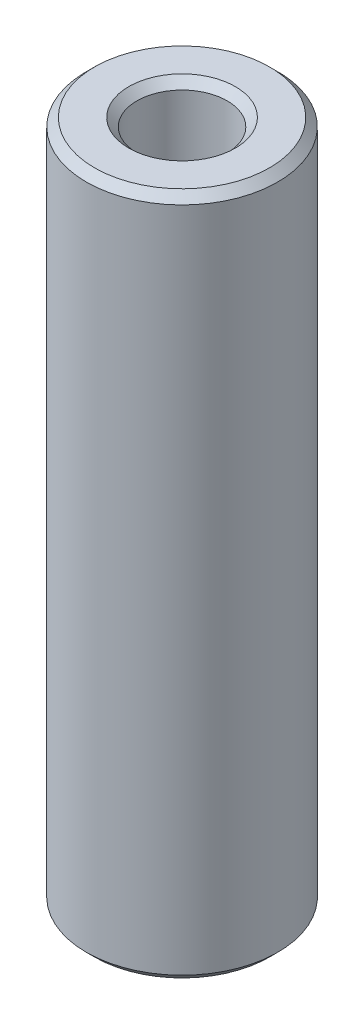
from build123d import *

# Parameters (mm, degrees)
SKETCH_1_R             = 3.5
SKETCH_1_R_2           = 1.65
EXTRUDE_1_DEPTH        = 25
HOLE_WIZARD_M4_1_D     = 3.3
HOLE_WIZARD_M4_1_DEPTH = 10
HOLE_WIZARD_M4_1_TIP   = 0.991420021
HOLE_WIZARD_M4_2_D     = 3.3
HOLE_WIZARD_M4_2_DEPTH = 10
HOLE_WIZARD_M4_2_TIP   = 0.991420021
CHAMFER_1_SIZE         = 0.3


with BuildPart() as part:
    # 스케치1 → 보스-돌출1 (new body)
    # profile 1 of 2: a face of its own
    with BuildSketch(Plane(origin=(0, 0, 0), x_dir=(1, 0, 0), z_dir=(0, 1, 0))):
        with Locations(Location((0, 0, 0), (0, 0, 270))):
            Circle(SKETCH_1_R)
        Circle(SKETCH_1_R_2, mode=Mode.SUBTRACT)
    # profile 2 of 2: a face of its own
    with BuildSketch(Plane(origin=(0, 0, 0), x_dir=(1, 0, 0), z_dir=(0, 1, 0))):
        Circle(SKETCH_1_R_2)
    extrude(amount=EXTRUDE_1_DEPTH)

    # M4 탭을 위한 탭 드릴1
    with Locations(Plane(origin=(0, 0, 0), x_dir=(-1, 0, 0), z_dir=(0, -1, 0))):
        with Locations((0, 0)):
            Hole(HOLE_WIZARD_M4_1_D / 2, depth=HOLE_WIZARD_M4_1_DEPTH)
            with Locations((0, 0, -(HOLE_WIZARD_M4_1_DEPTH + HOLE_WIZARD_M4_1_TIP / 2))):  # 118° drill point
                Cone(0, HOLE_WIZARD_M4_1_D / 2, HOLE_WIZARD_M4_1_TIP, mode=Mode.SUBTRACT)

    # M4 탭을 위한 탭 드릴2
    with Locations(Plane(origin=(0, 25, 0), x_dir=(1, 0, 0), z_dir=(0, 1, 0))):
        with Locations((0, 0)):
            Hole(HOLE_WIZARD_M4_2_D / 2, depth=HOLE_WIZARD_M4_2_DEPTH)
            with Locations((0, 0, -(HOLE_WIZARD_M4_2_DEPTH + HOLE_WIZARD_M4_2_TIP / 2))):  # 118° drill point
                Cone(0, HOLE_WIZARD_M4_2_D / 2, HOLE_WIZARD_M4_2_TIP, mode=Mode.SUBTRACT)

    # 모따기1
    chamfer_1_edges = [part.edges().sort_by_distance(p)[0] for p in [
        (1.65, 25, 0),
        (0, 0, -3.5),
        (0, 25, -3.5),
        (-1.65, 0, 0),
    ]]
    chamfer(chamfer_1_edges, length=CHAMFER_1_SIZE)


solid = part.part
